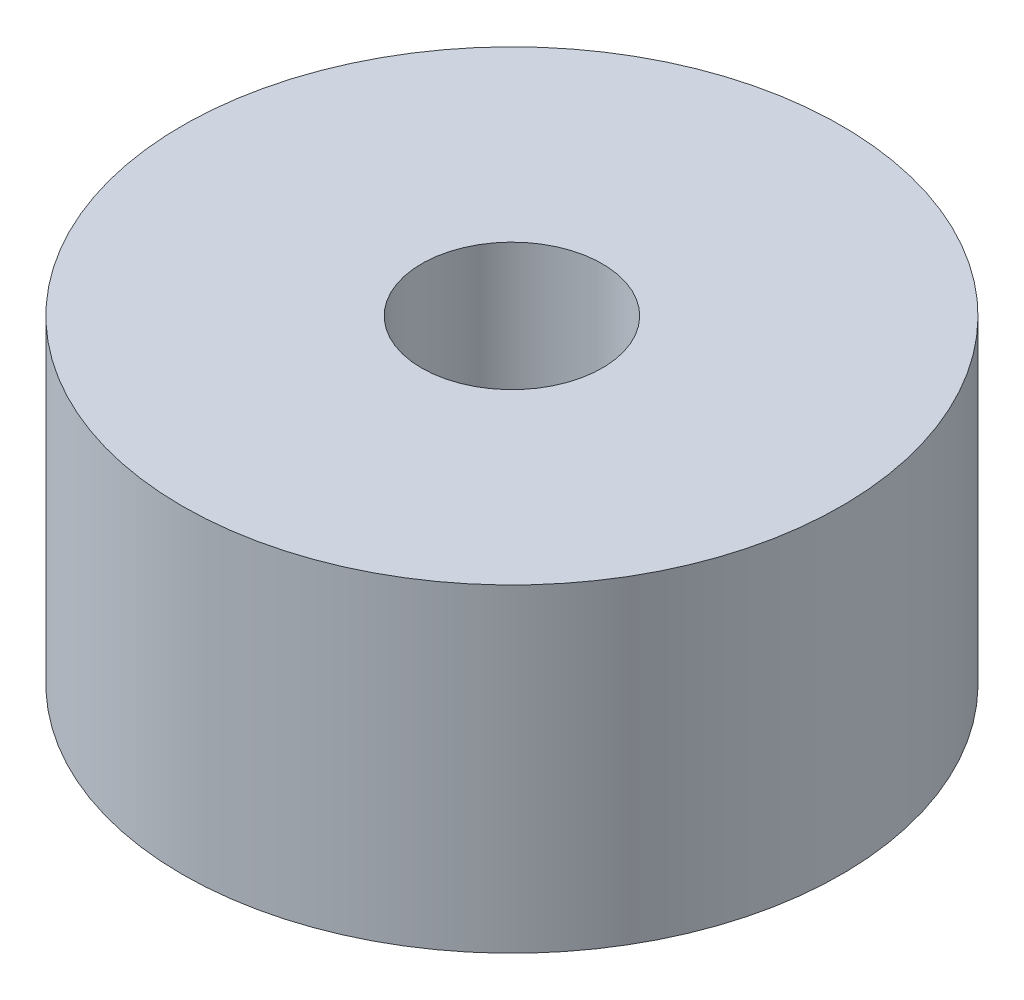
from build123d import *

# Parameters (mm, degrees)
SKETCH_1_R      = 15.5
SKETCH_1_R_2    = 4.25
EXTRUDE_1_DEPTH = 15


with BuildPart() as part:
    # Эскиз1 → Бобышка-Вытянуть1 (new body)
    with BuildSketch(Plane(origin=(0, 0, 0), x_dir=(1, 0, 0), z_dir=(0, 1, 0))):
        with Locations(Location((0, 0, 0), (0, 0, 270))):
            Circle(SKETCH_1_R)
        with Locations(Location((0, 0, 0), (0, 0, 270))):
            Circle(SKETCH_1_R_2, mode=Mode.SUBTRACT)
    extrude(amount=EXTRUDE_1_DEPTH)


solid = part.part
